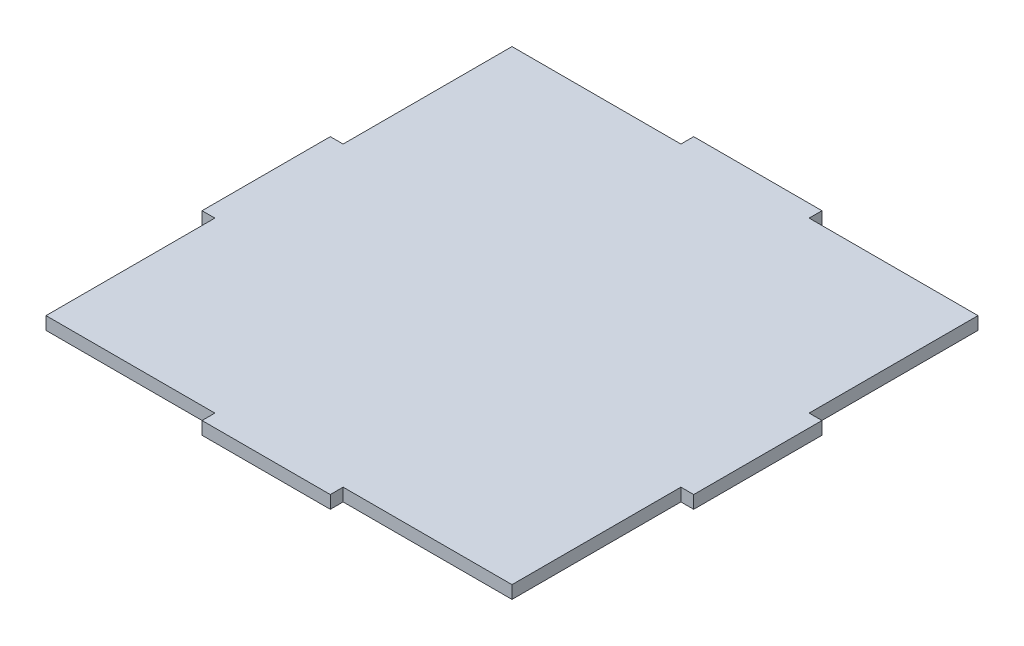
from build123d import *

# Parameters (mm, degrees)
SKETCH1_W           = 30
SKETCH1_H           = 3
SKETCH1_W_2         = 3
SKETCH1_H_2         = 30
BOSS_EXTRUDE1_DEPTH = 3


with BuildPart() as part:
    # Sketch1 → Boss-Extrude1 (new body)
    with BuildSketch(Plane(origin=(0, 0, 0), x_dir=(1, 0, 0), z_dir=(0, 1, 0))):
        with Locations((0, -56)):
            Rectangle(SKETCH1_W, SKETCH1_H)
        with Locations((-56, 0)):
            Rectangle(SKETCH1_W_2, SKETCH1_H_2)
        with Locations((0, 56)):
            Rectangle(SKETCH1_W, SKETCH1_H)
        Polygon((-54.5, -54.5), (-54.5, -15), (-54.5, 15), (-54.5, 54.5), (-15, 54.5), (15, 54.5), (54.5, 54.5), (54.5, 15), (54.5, -15), (54.5, -54.5), (15, -54.5), (-15, -54.5), align=None)
        with Locations((56, 0)):
            Rectangle(SKETCH1_W_2, SKETCH1_H_2)
    extrude(amount=BOSS_EXTRUDE1_DEPTH)


solid = part.part
